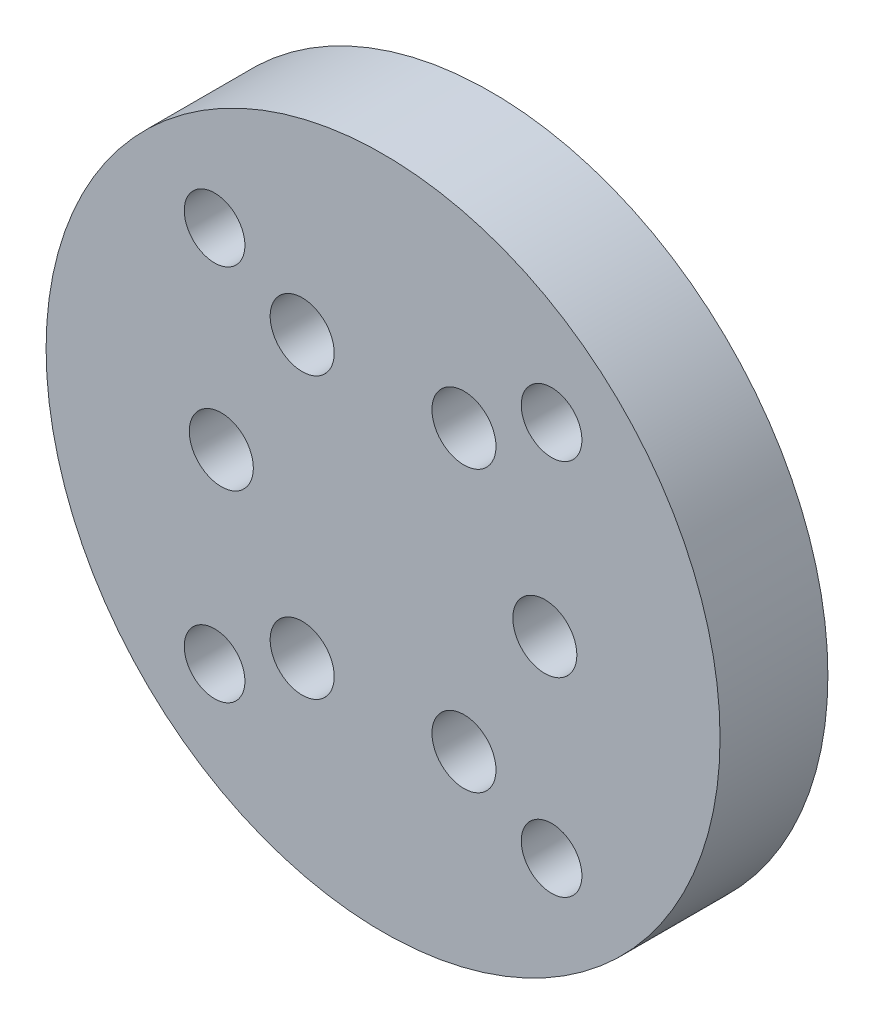
from build123d import *

# Parameters (mm, degrees)
SKETCH2_R               = 25
SKETCH2_R_2             = 4.025
SKETCH2_R_3             = 6.25
SKETCH2_R_4             = 2.375
BOSS_EXTRUDE2_DEPTH     = 8
CUT_EXTRUDE1_DEPTH      = 47.637413369
CUT_EXTRUDE1_DEPTH_BACK = 47.637413369
SKETCH3_R               = 2.25
SKETCH2_4_R             = 4.025
CUT_EXTRUDE2_DEPTH      = 4


with BuildPart() as part:
    # Sketch2 → Boss-Extrude2 (new body)
    # profile 1 of 8: a face of its own
    with BuildSketch(Plane.XY):
        with Locations((-3.028012221, -11.407126455)):
            Circle(SKETCH2_R)
        with Locations((-15.028012221, -11.407126455)):
            Circle(SKETCH2_R_2, mode=Mode.SUBTRACT)
        with Locations((-9.028012221, -1.014821609)):
            Circle(SKETCH2_R_2, mode=Mode.SUBTRACT)
        with Locations((2.971987779, -1.014821609)):
            Circle(SKETCH2_R_2, mode=Mode.SUBTRACT)
        with Locations((8.971987779, -11.407126455)):
            Circle(SKETCH2_R_2, mode=Mode.SUBTRACT)
        with Locations((2.971987779, -21.7994313)):
            Circle(SKETCH2_R_2, mode=Mode.SUBTRACT)
        with Locations((-9.028012221, -21.7994313)):
            Circle(SKETCH2_R_2, mode=Mode.SUBTRACT)
        with Locations((-3.028012221, -11.407126455)):
            Circle(SKETCH2_R_3, mode=Mode.SUBTRACT)
    # profile 2 of 8: a face of its own
    with BuildSketch(Plane.XY):
        with Locations((-15.028012221, -11.407126455)):
            Circle(SKETCH2_R_2)
        with Locations((-15.028012221, -11.407126455)):
            Circle(SKETCH2_R_4, mode=Mode.SUBTRACT)
    # profile 3 of 8: a face of its own
    with BuildSketch(Plane.XY):
        with Locations((-3.028012221, -11.407126455)):
            Circle(SKETCH2_R_3)
    # profile 4 of 8: a face of its own
    with BuildSketch(Plane.XY):
        with Locations((-9.028012221, -1.014821609)):
            Circle(SKETCH2_R_2)
        with Locations((-9.028012221, -1.014821609)):
            Circle(SKETCH2_R_4, mode=Mode.SUBTRACT)
    # profile 5 of 8: a face of its own
    with BuildSketch(Plane.XY):
        with Locations((2.971987779, -1.014821609)):
            Circle(SKETCH2_R_2)
        with Locations((2.971987779, -1.014821609)):
            Circle(SKETCH2_R_4, mode=Mode.SUBTRACT)
    # profile 6 of 8: a face of its own
    with BuildSketch(Plane.XY):
        with Locations((8.971987779, -11.407126455)):
            Circle(SKETCH2_R_2)
        with Locations((8.971987779, -11.407126455)):
            Circle(SKETCH2_R_4, mode=Mode.SUBTRACT)
    # profile 7 of 8: a face of its own
    with BuildSketch(Plane.XY):
        with Locations((2.971987779, -21.7994313)):
            Circle(SKETCH2_R_2)
        with Locations((2.971987779, -21.7994313)):
            Circle(SKETCH2_R_4, mode=Mode.SUBTRACT)
    # profile 8 of 8: a face of its own
    with BuildSketch(Plane.XY):
        with Locations((-9.028012221, -21.7994313)):
            Circle(SKETCH2_R_2)
        with Locations((-9.028012221, -21.7994313)):
            Circle(SKETCH2_R_4, mode=Mode.SUBTRACT)
    extrude(amount=BOSS_EXTRUDE2_DEPTH)

    # Sketch3 → Cut-Extrude1 (cut, two sides: drawn at the far end of the back side and taken through both)
    with BuildSketch(Plane(origin=(0, 0, 0), x_dir=(-1, 0, 0), z_dir=(0, 0, -1)).offset(-CUT_EXTRUDE1_DEPTH_BACK)):
        with Locations((-9.471987779, 2.592873545)):
            Circle(SKETCH3_R)
        with Locations((15.528012221, 2.592873545)):
            Circle(SKETCH3_R)
        with Locations((15.528012221, -25.407126455)):
            Circle(SKETCH3_R)
        with Locations((-9.471987779, -25.407126455)):
            Circle(SKETCH3_R)
    extrude(amount=CUT_EXTRUDE1_DEPTH + CUT_EXTRUDE1_DEPTH_BACK, mode=Mode.SUBTRACT)

    # Sketch2<4> → Cut-Extrude2 (cut)
    with BuildSketch(Plane.XY):
        with Locations((-15.028012221, -11.407126455)):
            Circle(SKETCH2_4_R)
        with Locations((-9.028012221, -1.014821609)):
            Circle(SKETCH2_4_R)
        with Locations((2.971987779, -1.014821609)):
            Circle(SKETCH2_4_R)
        with Locations((8.971987779, -11.407126455)):
            Circle(SKETCH2_4_R)
        with Locations((2.971987779, -21.7994313)):
            Circle(SKETCH2_4_R)
        with Locations((-9.028012221, -21.7994313)):
            Circle(SKETCH2_4_R)
    extrude(amount=CUT_EXTRUDE2_DEPTH, mode=Mode.SUBTRACT)


solid = part.part
